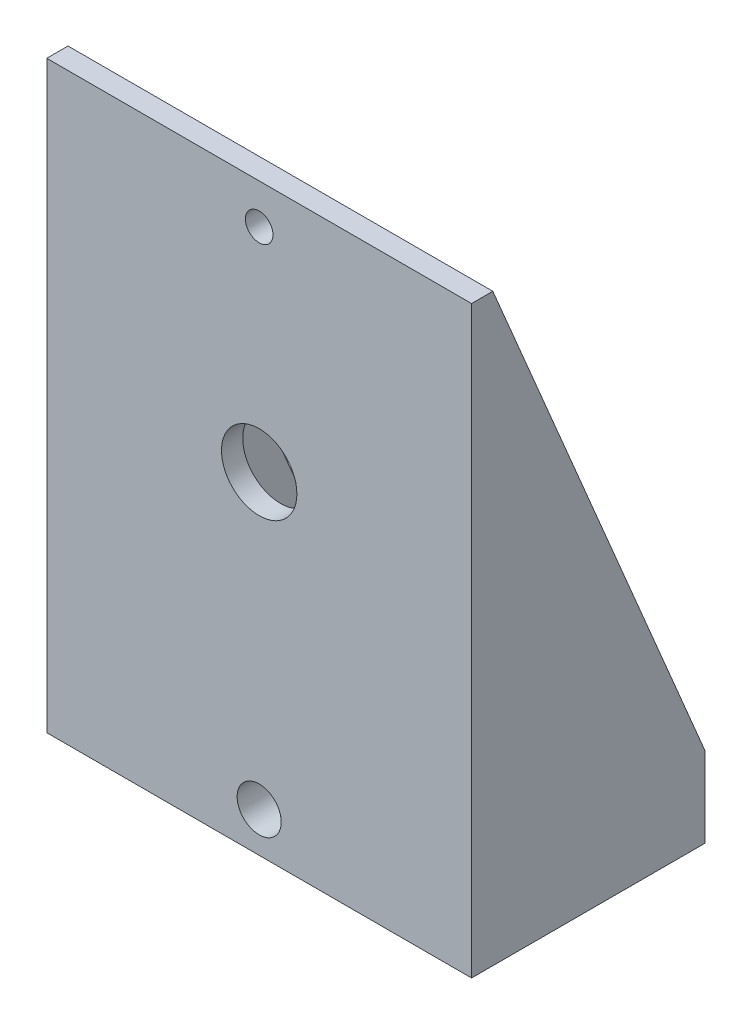
from build123d import *

# Parameters (mm, degrees)
SKETCH_1_W          = 80
SKETCH_1_H          = 110
EXTRUDE_1_DEPTH     = 4
SKETCH_2_R          = 7.1
SKETCH_2_R_2        = 2.6
CUT_EXTRUDE_1_DEPTH = 137.073509545
SKETCH_3_W          = 80
SKETCH_3_H          = 15
EXTRUDE_2_DEPTH     = 40
SKETCH_4_R          = 4.15
CUT_EXTRUDE_2_DEPTH = 143.954538228
EXTRUDE_3_DEPTH     = 7
EXTRUDE_4_DEPTH     = 7


with BuildPart() as part:
    # 草图1 → 凸台-拉伸1 (new body)
    with BuildSketch(Plane.XY):
        with Locations((40, -55)):
            Rectangle(SKETCH_1_W, SKETCH_1_H)
    extrude(amount=EXTRUDE_1_DEPTH)

    # 草图2 → 切除-拉伸1 (cut, through all)
    with BuildSketch(Plane.XY.offset(4)):
        with Locations((40, -47.5)):
            Circle(SKETCH_2_R)
        with Locations((40, -7.5)):
            Circle(SKETCH_2_R_2)
    extrude(amount=-CUT_EXTRUDE_1_DEPTH, mode=Mode.SUBTRACT)

    # 草图3 → 凸台-拉伸2 (add)
    with BuildSketch(Plane(origin=(0, 0, 0), x_dir=(-1, 0, 0), z_dir=(0, 0, -1))):
        with Locations((-40, -102.5)):
            Rectangle(SKETCH_3_W, SKETCH_3_H)
    extrude(amount=EXTRUDE_2_DEPTH)

    # 草图4 → 切除-拉伸2 (cut, through all)
    with BuildSketch(Plane(origin=(0, 0, -40), x_dir=(-1, 0, 0), z_dir=(0, 0, -1))):
        with Locations((-40, -102.5)):
            Circle(SKETCH_4_R)
    extrude(amount=-CUT_EXTRUDE_2_DEPTH, mode=Mode.SUBTRACT)

    # 草图5 → 凸台-拉伸3 (add)
    with BuildSketch(Plane(origin=(80, 0, 0), x_dir=(0, 0, -1), z_dir=(1, 0, 0))):
        Polygon((0, 0), (0, -95), (40, -95), align=None)
    extrude(amount=-EXTRUDE_3_DEPTH)

    # 草图6 → 凸台-拉伸4 (add)
    with BuildSketch(Plane.ZY):
        Polygon((0, 0), (0, -95), (-40, -95), align=None)
    extrude(amount=-EXTRUDE_4_DEPTH)


solid = part.part
